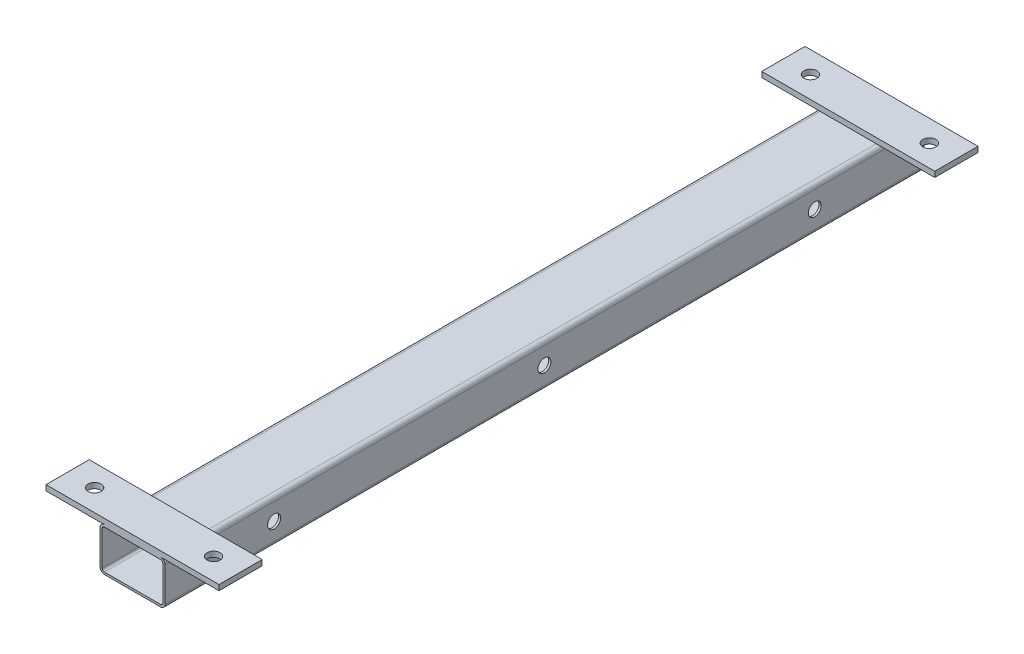
from build123d import *

# Parameters (mm, degrees)
DODANIE_WYCI_GNI_CIE1_DEPTH = 702
SZKIC2_R                    = 6
DODANIE_WYCI_GNI_CIE2_DEPTH = 5
SZKIC4_R                    = 6
WYTNIJ_WYCI_GNI_CIE1_DEPTH  = 65


with BuildPart() as part:
    # Szkic1 → Dodanie-wyciągnięcie1 (new body)
    with BuildSketch(Plane.XY):
        with BuildLine():
            Line((0, 4), (0, 36))
            ThreePointArc((0, 36), (1.171572875, 38.828427125), (4, 40))
            Line((4, 40), (56, 40))
            ThreePointArc((56, 40), (58.828427125, 38.828427125), (60, 36))
            Line((60, 36), (60, 4))
            ThreePointArc((60, 4), (58.828427125, 1.171572875), (56, 0))
            Line((56, 0), (4, 0))
            ThreePointArc((4, 0), (1.171572875, 1.171572875), (0, 4))
        make_face()
        with BuildLine():
            Line((2, 4), (2, 36))
            ThreePointArc((2, 36), (2.585786438, 37.414213562), (4, 38))
            Line((4, 38), (56, 38))
            ThreePointArc((56, 38), (57.414213562, 37.414213562), (58, 36))
            Line((58, 36), (58, 4))
            ThreePointArc((58, 4), (57.414213562, 2.585786438), (56, 2))
            Line((56, 2), (4, 2))
            ThreePointArc((4, 2), (2.585786438, 2.585786438), (2, 4))
        make_face(mode=Mode.SUBTRACT)
    extrude(amount=DODANIE_WYCI_GNI_CIE1_DEPTH)

    # Szkic2 → Dodanie-wyciągnięcie2 (add)
    with BuildSketch(Plane(origin=(0, 40, 0), x_dir=(1, 0, 0), z_dir=(0, 1, 0))):
        Polygon((0, 0), (-50, 0), (-50, -40), (110, -40), (110, 0), align=None)
        with Locations(Location((-25, -20, 0), (0, 0, 270))):
            Circle(SZKIC2_R, mode=Mode.SUBTRACT)
        with Locations(Location((85, -20, 0), (0, 0, 270))):
            Circle(SZKIC2_R, mode=Mode.SUBTRACT)
    dodanie_wyci_gni_cie2 = extrude(amount=DODANIE_WYCI_GNI_CIE2_DEPTH)

    # Lustro1: Dodanie-wyciągnięcie2 across plane
    add(dodanie_wyci_gni_cie2.mirror(Plane(origin=(0, 0, 351), x_dir=(1, 0, 0), z_dir=(0, 0, -1))))

    # Szkic4 → Wytnij-wyciągnięcie1 (cut)
    with BuildSketch(Plane(origin=(60, 0, 0), x_dir=(0, 0, -1), z_dir=(1, 0, 0))):
        with Locations((-101, 20)):
            Circle(SZKIC4_R)
        with Locations((-351, 20)):
            Circle(SZKIC4_R)
        with Locations((-601, 20)):
            Circle(SZKIC4_R)
    extrude(amount=-WYTNIJ_WYCI_GNI_CIE1_DEPTH, mode=Mode.SUBTRACT)


solid = part.part
